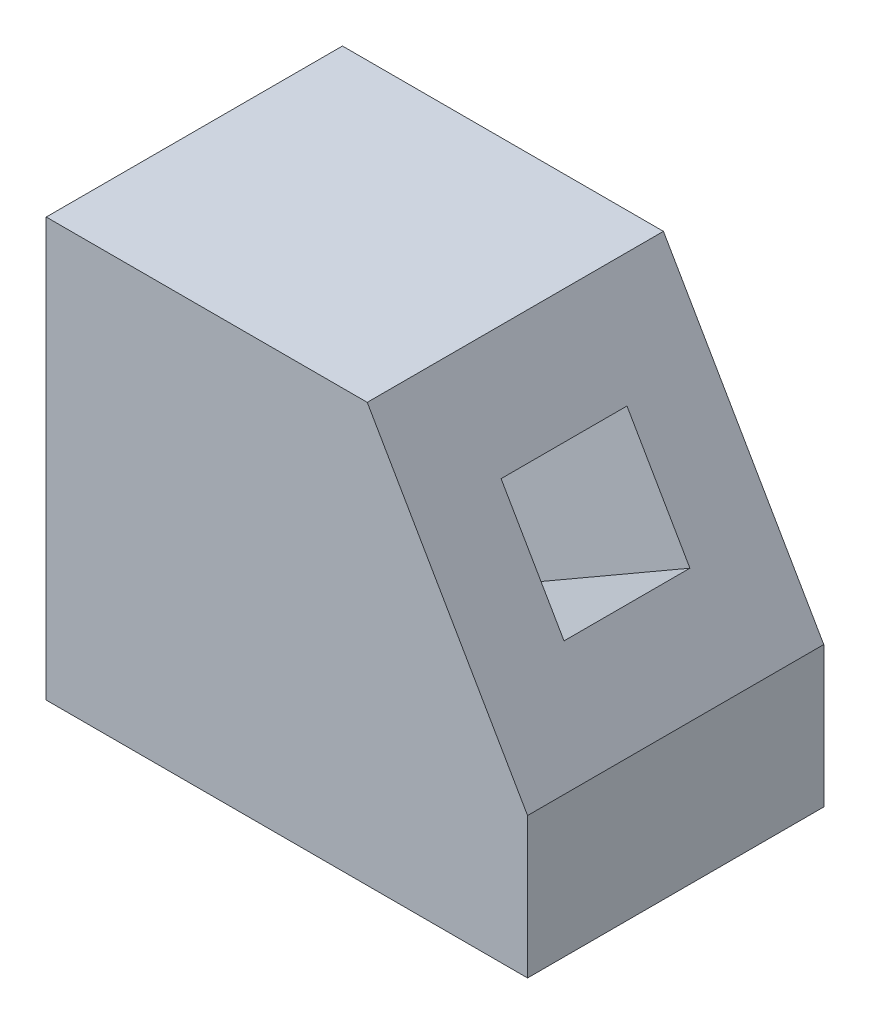
from build123d import *

# Parameters (mm, degrees)
SKETCH_1_W          = 13
SKETCH_1_H          = 8
EXTRUDE_1_DEPTH     = 11.3
CUT_EXTRUDE_1_REACH = 20.992
SKETCH_3_W          = 3.4
SKETCH_3_H          = 3.4
CUT_EXTRUDE_2_DEPTH = 12


with BuildPart() as part:
    # 草图1 → 凸台-拉伸1 (new body)
    with BuildSketch(Plane(origin=(0, 0, 0), x_dir=(1, 0, 0), z_dir=(0, 1, 0))):
        with Locations((6.5, 4)):
            Rectangle(SKETCH_1_W, SKETCH_1_H)
    extrude(amount=EXTRUDE_1_DEPTH)

    # 草图2 → 切除-拉伸1 (cut, up to next)
    with BuildSketch(Plane(origin=(0, 0, -8), x_dir=(-1, 0, 0), z_dir=(0, 0, -1)), mode=Mode.PRIVATE) as cut_extrude_1_sk1:
        Polygon((-13, 3.8), (-8.669872981, 11.3), (-13, 11.3), align=None)
    cut_extrude_1_tool1 = extrude(cut_extrude_1_sk1.sketch, amount=-CUT_EXTRUDE_1_REACH, mode=Mode.PRIVATE) & part.part
    add(cut_extrude_1_tool1.solids().sort_by_distance((11.556624, 8.8, -8))[0], mode=Mode.SUBTRACT)

    # 草图3 → 切除-拉伸2 (cut)
    with BuildSketch(Plane(origin=(11.395448267, 6.579165125, 0), x_dir=(0, 0, -1), z_dir=(0.8660254037844417, 0.4999999999999948, 0))):
        with Locations((4, 1.121023553)):
            Rectangle(SKETCH_3_W, SKETCH_3_H)
    extrude(amount=-CUT_EXTRUDE_2_DEPTH, mode=Mode.SUBTRACT)


solid = part.part
